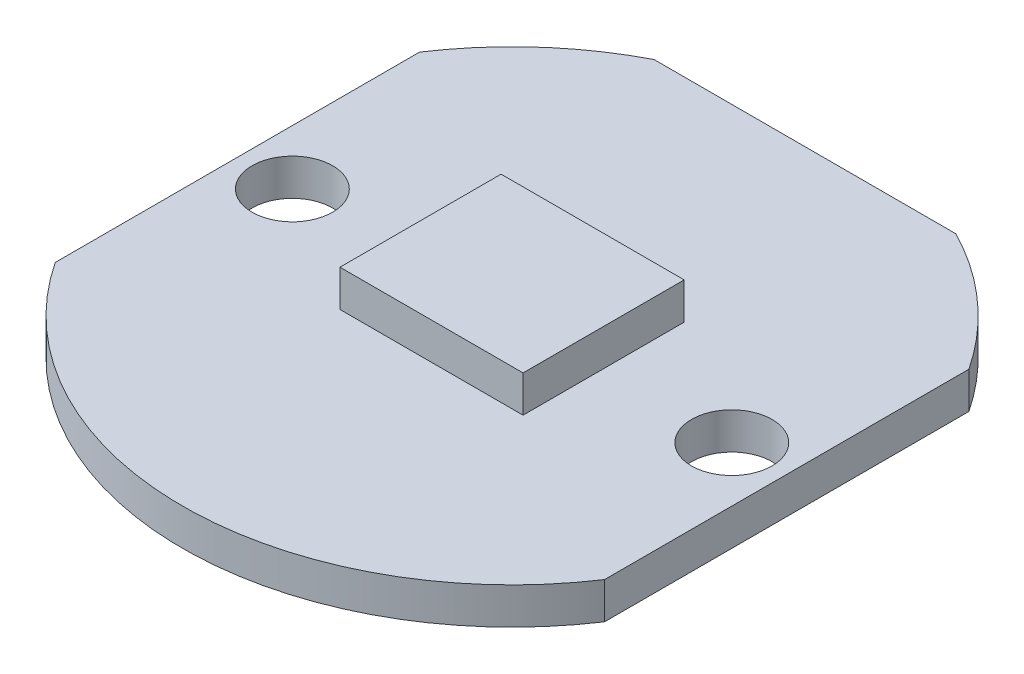
from build123d import *

# Parameters (mm, degrees)
SKETCH_1_R      = 1.1
EXTRUDE_1_DEPTH = 1
EXTRUDE_START   = 1
SKETCH_3_W      = 5
SKETCH_3_H      = 4.4
EXTRUDE_2_DEPTH = 1


with BuildPart() as part:
    # Эскиз1 → Бобышка-Вытянуть1 (new body)
    with BuildSketch(Plane(origin=(0, 0, 0), x_dir=(1, 0, 0), z_dir=(0, 1, 0))):
        with BuildLine():
            Line((4.123105626, 8), (-4.123105626, 8))
            ThreePointArc((-4.123105626, 8), (-6.005155898, 6.703588789), (-7.5, 4.974937186))
            Line((-7.5, 4.974937186), (-7.5, -4.974937186))
            ThreePointArc((-7.5, -4.974937186), (0, -9), (7.5, -4.974937186))
            Line((7.5, -4.974937186), (7.5, 4.974937186))
            ThreePointArc((7.5, 4.974937186), (6.005155898, 6.703588789), (4.123105626, 8))
        make_face()
        with Locations(Location((-6, 0, 0), (0, 0, 270))):
            Circle(SKETCH_1_R, mode=Mode.SUBTRACT)
        with Locations(Location((6, 0, 0), (0, 0, 270))):
            Circle(SKETCH_1_R, mode=Mode.SUBTRACT)
    extrude(amount=EXTRUDE_1_DEPTH)


with BuildPart() as body_2:
    # Эскиз3 → Бобышка-Вытянуть2 (new body)
    with BuildSketch(Plane(origin=(0, 0, 0), x_dir=(1, 0, 0), z_dir=(0, 1, 0)).offset(EXTRUDE_START)):
        Rectangle(SKETCH_3_W, SKETCH_3_H)
    extrude(amount=EXTRUDE_2_DEPTH)


solid = Compound([part.part, body_2.part])
